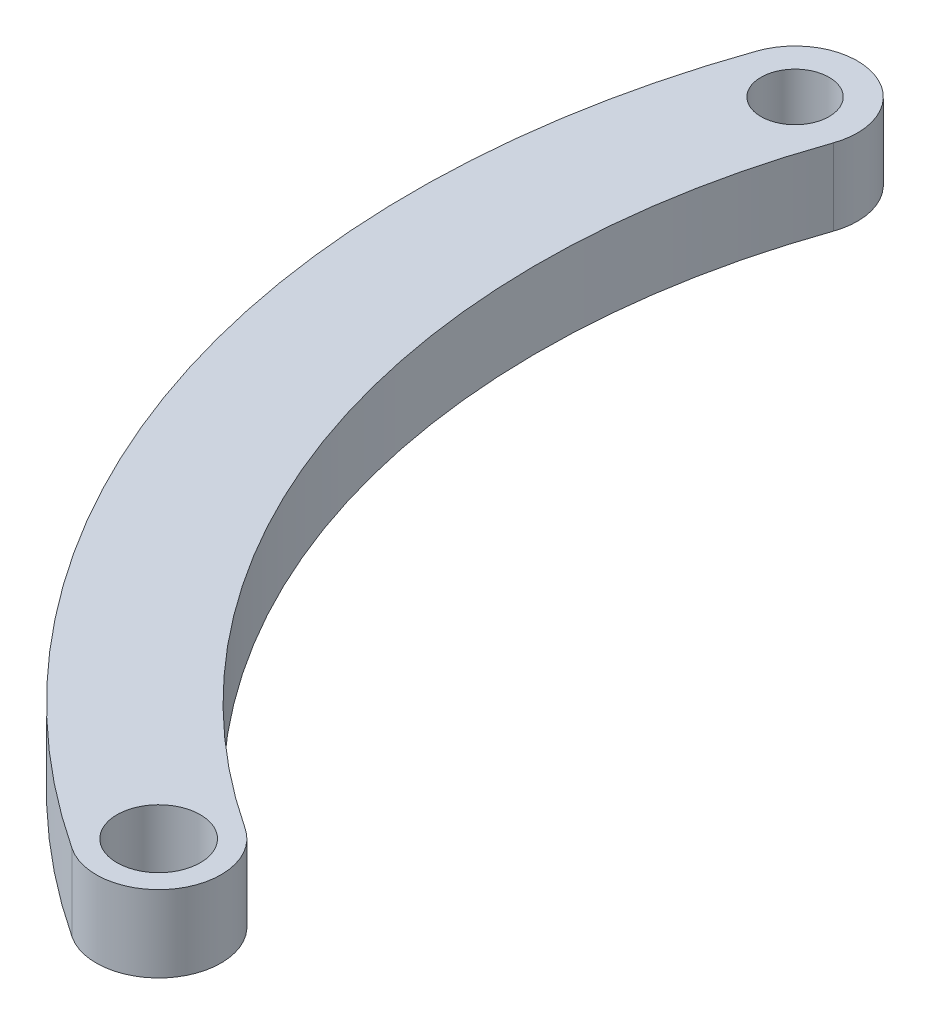
from build123d import *

# Parameters (mm, degrees)
SKETCH1_R           = 2.671888706
SKETCH1_R_2         = 3.265770333
BOSS_EXTRUDE1_DEPTH = 6


with BuildPart() as part:
    # Sketch1 → Boss-Extrude1 (new body)
    with BuildSketch(Plane(origin=(0, 0, 0), x_dir=(1, 0, 0), z_dir=(0, 1, 0))):
        with BuildLine():
            ThreePointArc((-65.565708052, 22.996927451), (-65.833238064, -22.219484929), (-38.219631037, -58.02568869))
            ThreePointArc((-38.219631037, -58.02568869), (-31.441280965, -56.630790811), (-32.836178844, -49.852440739))
            ThreePointArc((-32.836178844, -49.852440739), (-56.560252422, -19.089744227), (-56.330405532, 19.757679552))
            ThreePointArc((-56.330405532, 19.757679552), (-59.328432843, 25.994954762), (-65.565708052, 22.996927451))
        make_face()
        with Locations(Location((-60.948056792, 21.377303502, 0), (0, 0, 270))):
            Circle(SKETCH1_R, mode=Mode.SUBTRACT)
        with Locations(Location((-35.52790494, -53.939064714, 0), (0, 0, 270))):
            Circle(SKETCH1_R_2, mode=Mode.SUBTRACT)
    extrude(amount=BOSS_EXTRUDE1_DEPTH)


solid = part.part
